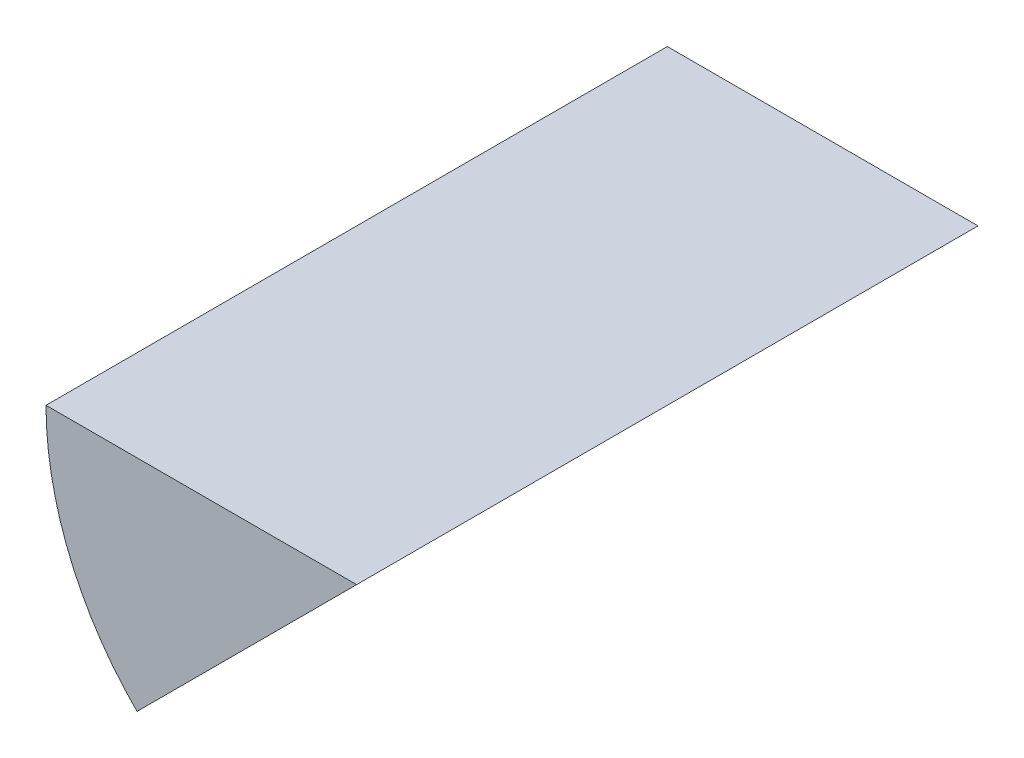
from build123d import *

# Parameters (mm, degrees)
SALIENTE_EXTRUIR1_DEPTH = 50
CROQUIS2_R              = 5
CORTAR_EXTRUIR1_DEPTH   = 10


with BuildPart() as part:
    # Croquis1 → Saliente-Extruir1 (new body)
    with BuildSketch(Plane.XY):
        with BuildLine():
            Line((0, 0), (-25, 0))
            ThreePointArc((-25, 0), (-23.096988313, -9.567085809), (-17.67766953, -17.67766953))
            Line((-17.67766953, -17.67766953), (0, 0))
        make_face()
    extrude(amount=SALIENTE_EXTRUIR1_DEPTH)

    # Croquis2 → Cortar-Extruir1 (cut)
    with BuildSketch(Plane(origin=(0, 0, 0), x_dir=(-1, 0, 0), z_dir=(0, 0, -1))):
        with Locations((16.176912097, -6.228100476)):
            Circle(CROQUIS2_R)
    extrude(amount=-CORTAR_EXTRUIR1_DEPTH, mode=Mode.SUBTRACT)


solid = part.part
